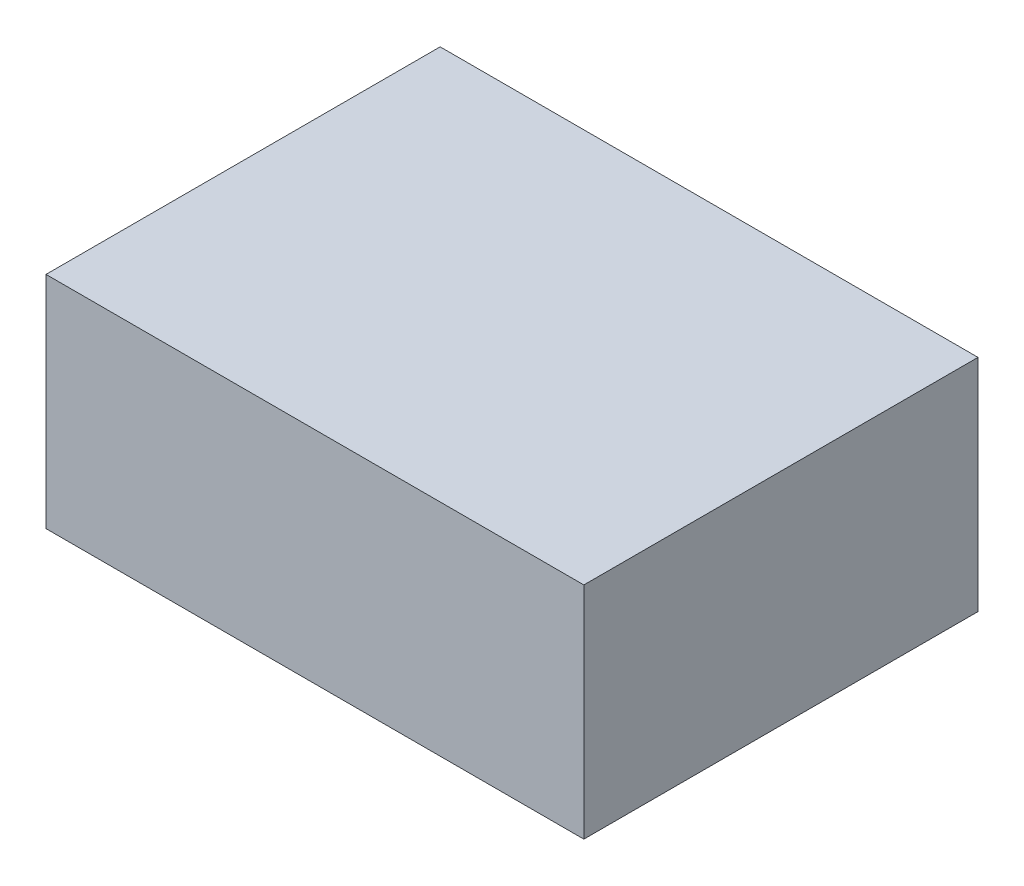
from build123d import *

# Parameters (mm, degrees)
SKETCH1_W      = 64
SKETCH1_H      = 26.2
ENVELOPE_DEPTH = 46.9


with BuildPart() as part:
    # Sketch1 → Envelope (new body)
    with BuildSketch(Plane.XY):
        Rectangle(SKETCH1_W, SKETCH1_H)
    extrude(amount=ENVELOPE_DEPTH)


solid = part.part
